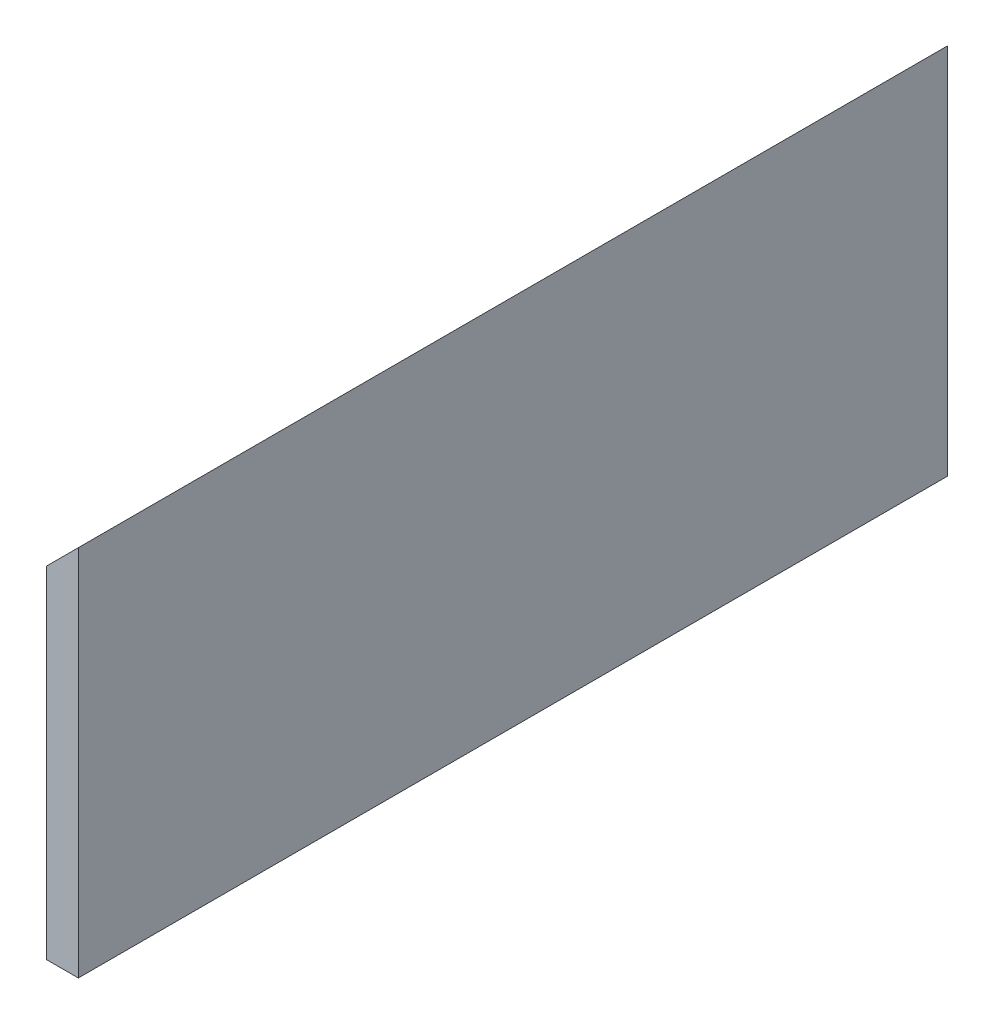
from build123d import *

# Parameters (mm, degrees)
IZIM1_W                     = 275
IZIM1_H                     = 117.95
Y_KSEKLIK_EKSTR_ZYON1_DEPTH = 10
KES_EKSTR_ZYON1_DEPTH       = 300.394726907


with BuildPart() as part:
    # Çizim1 → Yükseklik-Ekstrüzyon1 (new body)
    with BuildSketch(Plane(origin=(0, 0, 0), x_dir=(0, 0, -1), z_dir=(1, 0, 0))):
        with Locations((137.5, 58.975)):
            Rectangle(IZIM1_W, IZIM1_H)
    extrude(amount=Y_KSEKLIK_EKSTR_ZYON1_DEPTH)

    # Çizim2 → Kes-Ekstrüzyon1 (cut, through all)
    with BuildSketch(Plane(origin=(0, 0, -275), x_dir=(-1, 0, 0), z_dir=(0, 0, -1))):
        Polygon((-10, 117.95), (0, 107.95), (0, 117.95), align=None)
    extrude(amount=-KES_EKSTR_ZYON1_DEPTH, mode=Mode.SUBTRACT)


solid = part.part
